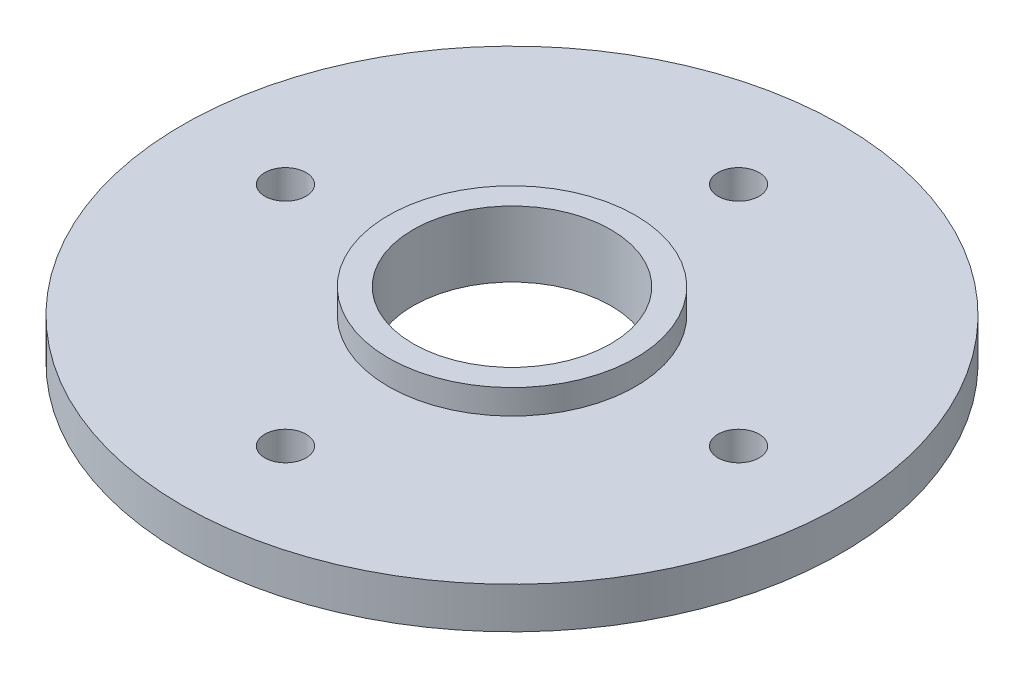
from build123d import *

# Parameters (mm, degrees)
SKETCH1_R             = 40
BOSS_EXTRUDE1_DEPTH   = 5
SKETCH2_R             = 15
SKETCH2_R_2           = 12
BOSS_EXTRUDE2_DEPTH   = 3
SKETCH3_R             = 12
CUT_EXTRUDE1_DEPTH    = 57.789083458
F_5_0MM_DOWEL_HOLE1_D = 5
CIRPATTERN1_COUNT     = 4


with BuildPart() as part:
    # Sketch1 → Boss-Extrude1 (new body)
    with BuildSketch(Plane(origin=(0, 0, 0), x_dir=(1, 0, 0), z_dir=(0, 1, 0))):
        with Locations(Location((0, 0, 0), (0, 0, 270))):
            Circle(SKETCH1_R)
    extrude(amount=BOSS_EXTRUDE1_DEPTH)

    # Sketch2 → Boss-Extrude2 (add)
    with BuildSketch(Plane(origin=(0, 5, 0), x_dir=(1, 0, 0), z_dir=(0, 1, 0))):
        with Locations(Location((0, 0, 0), (0, 0, 270))):
            Circle(SKETCH2_R)
        with Locations(Location((0, 0, 0), (0, 0, 270))):
            Circle(SKETCH2_R_2, mode=Mode.SUBTRACT)
    extrude(amount=BOSS_EXTRUDE2_DEPTH)

    # Sketch3 → Cut-Extrude1 (cut, through all)
    with BuildSketch(Plane(origin=(0, 5, 0), x_dir=(1, 0, 0), z_dir=(0, 1, 0))):
        with Locations(Location((0, 0, 0), (0, 0, 270))):
            Circle(SKETCH3_R)
    extrude(amount=-CUT_EXTRUDE1_DEPTH, mode=Mode.SUBTRACT)

    # Ø5.0mm Dowel Hole1 (through all)
    with Locations(Plane(origin=(0, 5, -27.5), x_dir=(0, 0, 1), z_dir=(0, 1, 0))):
        with Locations((0, 0)):
            f_5_0mm_dowel_hole1 = Hole(F_5_0MM_DOWEL_HOLE1_D / 2)

    # CirPattern1: Ø5.0mm Dowel Hole1 ×4 about axis
    cirpattern1_axis = Axis((0, 0, 0), (0, 1, 0))
    for i in range(1, CIRPATTERN1_COUNT):
        add(f_5_0mm_dowel_hole1.rotate(cirpattern1_axis, i * 360 / CIRPATTERN1_COUNT), mode=Mode.SUBTRACT)


solid = part.part
